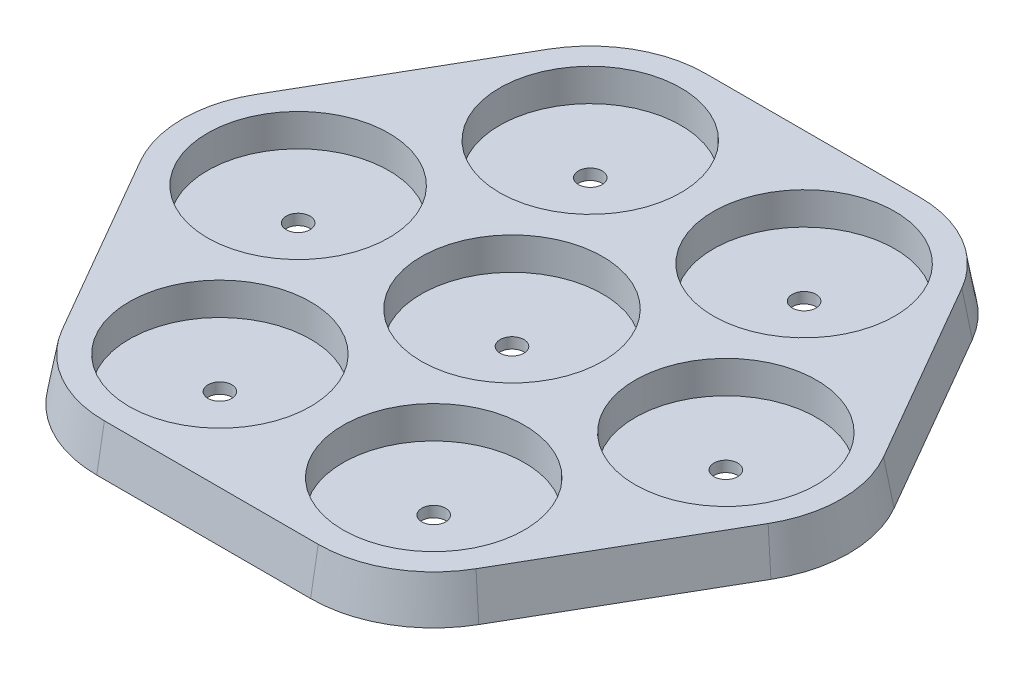
from build123d import *

# Parameters (mm, degrees)
BOSS_EXTRUDE1_DEPTH = 4
BOSS_EXTRUDE1_TAPER = 10
CUT_EXTRUDE1_START  = 4
SKETCH1_3_R         = 1.1
CUT_EXTRUDE1_DEPTH  = 4
CUT_EXTRUDE2_START  = 4
SKETCH1_4_R         = 8.4
SKETCH1_4_R_2       = 1.1
CUT_EXTRUDE2_DEPTH  = 3


with BuildPart() as part:
    # Sketch1 → Boss-Extrude1 (new body)
    with BuildSketch(Plane(origin=(0, 0, 0), x_dir=(1, 0, 0), z_dir=(0, 1, 0))):
        with BuildLine():
            ThreePointArc((-29.7, 28.547302995), (-35.4, 27.019992598), (-39.572689603, 22.847302995))
            Line((-39.572689603, 22.847302995), (-49.472689603, 5.7))
            ThreePointArc((-49.472689603, 5.7), (-51, 0), (-49.472689603, -5.7))
            Line((-49.472689603, -5.7), (-39.572689603, -22.847302995))
            ThreePointArc((-39.572689603, -22.847302995), (-35.4, -27.019992598), (-29.7, -28.547302995))
            Line((-29.7, -28.547302995), (-9.9, -28.547302995))
            ThreePointArc((-9.9, -28.547302995), (-4.2, -27.019992598), (-0.027310397, -22.847302995))
            Line((-0.027310397, -22.847302995), (9.872689603, -5.7))
            ThreePointArc((9.872689603, -5.7), (11.4, 0), (9.872689603, 5.7))
            Line((9.872689603, 5.7), (-0.027310397, 22.847302995))
            ThreePointArc((-0.027310397, 22.847302995), (-4.2, 27.019992598), (-9.9, 28.547302995))
            Line((-9.9, 28.547302995), (-29.7, 28.547302995))
        make_face()
    extrude(amount=BOSS_EXTRUDE1_DEPTH, taper=BOSS_EXTRUDE1_TAPER)

    # Sketch1<3> → Cut-Extrude1 (cut)
    with BuildSketch(Plane(origin=(0, 0, 0), x_dir=(1, 0, 0), z_dir=(0, 1, 0)).offset(CUT_EXTRUDE1_START)):
        with Locations(Location((-9.9, -17.147302995, 0), (0, 0, 270))):
            Circle(SKETCH1_3_R)
        with Locations(Location((0, 0, 0), (0, 0, 270))):
            Circle(SKETCH1_3_R)
        with Locations(Location((-29.7, -17.147302995, 0), (0, 0, 270))):
            Circle(SKETCH1_3_R)
        with Locations(Location((-39.6, 0, 0), (0, 0, 270))):
            Circle(SKETCH1_3_R)
        with Locations(Location((-9.9, 17.147302995, 0), (0, 0, 270))):
            Circle(SKETCH1_3_R)
        with Locations(Location((-29.7, 17.147302995, 0), (0, 0, 270))):
            Circle(SKETCH1_3_R)
        with Locations(Location((-19.8, 0, 0), (0, 0, 270))):
            Circle(SKETCH1_3_R)
    extrude(amount=-CUT_EXTRUDE1_DEPTH, mode=Mode.SUBTRACT)

    # Sketch1<4> → Cut-Extrude2 (cut)
    # profile 1 of 7: a face of its own
    with BuildSketch(Plane(origin=(0, 0, 0), x_dir=(1, 0, 0), z_dir=(0, 1, 0)).offset(CUT_EXTRUDE2_START)):
        with Locations(Location((-19.8, 0, 0), (0, 0, 270))):
            Circle(SKETCH1_4_R)
        with Locations(Location((-19.8, 0, 0), (0, 0, 270))):
            Circle(SKETCH1_4_R_2, mode=Mode.SUBTRACT)
    # profile 2 of 7: a face of its own
    with BuildSketch(Plane(origin=(0, 0, 0), x_dir=(1, 0, 0), z_dir=(0, 1, 0)).offset(CUT_EXTRUDE2_START)):
        with Locations(Location((-9.9, -17.147302995, 0), (0, 0, 270))):
            Circle(SKETCH1_4_R)
        with Locations(Location((-9.9, -17.147302995, 0), (0, 0, 270))):
            Circle(SKETCH1_4_R_2, mode=Mode.SUBTRACT)
    # profile 3 of 7: a face of its own
    with BuildSketch(Plane(origin=(0, 0, 0), x_dir=(1, 0, 0), z_dir=(0, 1, 0)).offset(CUT_EXTRUDE2_START)):
        with Locations(Location((0, 0, 0), (0, 0, 270))):
            Circle(SKETCH1_4_R)
        with Locations(Location((0, 0, 0), (0, 0, 270))):
            Circle(SKETCH1_4_R_2, mode=Mode.SUBTRACT)
    # profile 4 of 7: a face of its own
    with BuildSketch(Plane(origin=(0, 0, 0), x_dir=(1, 0, 0), z_dir=(0, 1, 0)).offset(CUT_EXTRUDE2_START)):
        with Locations(Location((-29.7, -17.147302995, 0), (0, 0, 270))):
            Circle(SKETCH1_4_R)
        with Locations(Location((-29.7, -17.147302995, 0), (0, 0, 270))):
            Circle(SKETCH1_4_R_2, mode=Mode.SUBTRACT)
    # profile 5 of 7: a face of its own
    with BuildSketch(Plane(origin=(0, 0, 0), x_dir=(1, 0, 0), z_dir=(0, 1, 0)).offset(CUT_EXTRUDE2_START)):
        with Locations(Location((-39.6, 0, 0), (0, 0, 270))):
            Circle(SKETCH1_4_R)
        with Locations(Location((-39.6, 0, 0), (0, 0, 270))):
            Circle(SKETCH1_4_R_2, mode=Mode.SUBTRACT)
    # profile 6 of 7: a face of its own
    with BuildSketch(Plane(origin=(0, 0, 0), x_dir=(1, 0, 0), z_dir=(0, 1, 0)).offset(CUT_EXTRUDE2_START)):
        with Locations(Location((-9.9, 17.147302995, 0), (0, 0, 270))):
            Circle(SKETCH1_4_R)
        with Locations(Location((-9.9, 17.147302995, 0), (0, 0, 270))):
            Circle(SKETCH1_4_R_2, mode=Mode.SUBTRACT)
    # profile 7 of 7: a face of its own
    with BuildSketch(Plane(origin=(0, 0, 0), x_dir=(1, 0, 0), z_dir=(0, 1, 0)).offset(CUT_EXTRUDE2_START)):
        with Locations(Location((-29.7, 17.147302995, 0), (0, 0, 270))):
            Circle(SKETCH1_4_R)
        with Locations(Location((-29.7, 17.147302995, 0), (0, 0, 270))):
            Circle(SKETCH1_4_R_2, mode=Mode.SUBTRACT)
    extrude(amount=-CUT_EXTRUDE2_DEPTH, mode=Mode.SUBTRACT)


solid = part.part
